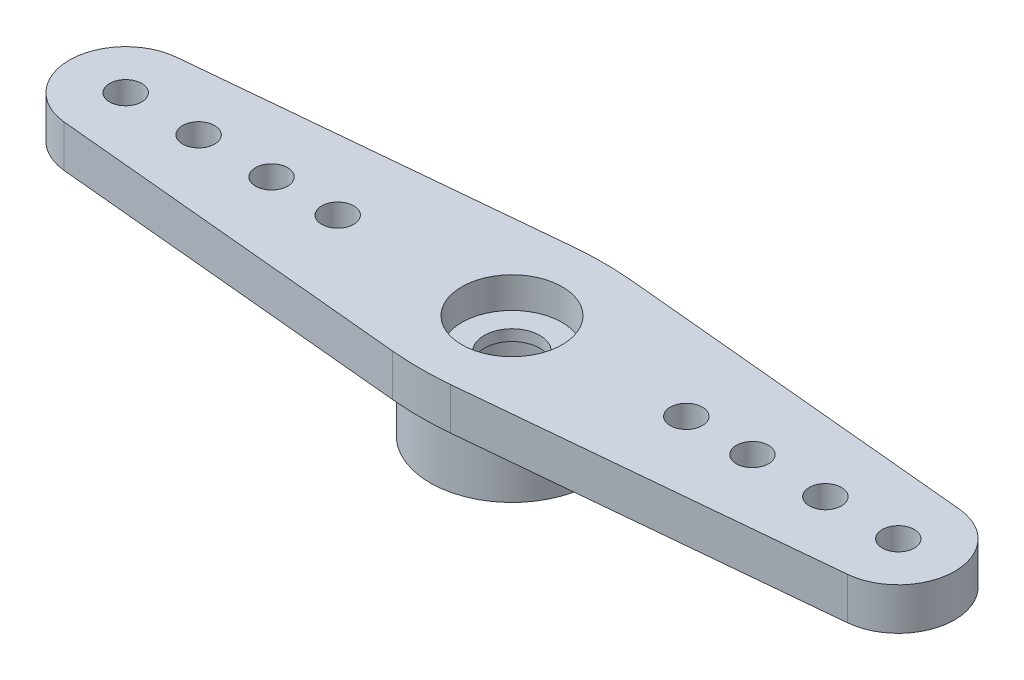
from build123d import *

# Parameters (mm, degrees)
SKETCH1_R           = 3.3655
SKETCH1_R_2         = 2.2352
BOSS_EXTRUDE1_DEPTH = 2.54
SKETCH2_R           = 0.6604
SKETCH2_R_2         = 2.31775
SKETCH2_R_3         = 3.3655
SKETCH2_R_4         = 2.2352
SKETCH2_R_5         = 1.143
BOSS_EXTRUDE2_DEPTH = 1.7272
FILLET1_R           = 12.7
CUT_EXTRUDE1_START  = -1.27
SKETCH3_R           = 2.06375
SKETCH3_R_2         = 1.143
CUT_EXTRUDE1_DEPTH  = 1.27
SCALE1_SCALE        = 1.483924155


with BuildPart() as part:
    # Sketch1 → Boss-Extrude1 (new body)
    with BuildSketch(Plane(origin=(0, 0, 0), x_dir=(1, 0, 0), z_dir=(0, 1, 0))):
        with Locations(Location((0, 0, 0), (0, 0, 270))):
            Circle(SKETCH1_R)
        with Locations(Location((0, 0, 0), (0, 0, 270))):
            Circle(SKETCH1_R_2, mode=Mode.SUBTRACT)
    extrude(amount=BOSS_EXTRUDE1_DEPTH)

    # Sketch2 → Boss-Extrude2 (add)
    # profile 1 of 7: a face of its own
    with BuildSketch(Plane(origin=(0, 2.54, 0), x_dir=(1, 0, 0), z_dir=(0, 1, 0))):
        with BuildLine():
            ThreePointArc((-0.713521748, -3.755518873), (-3.8227, 0), (-0.713521748, 3.755518873))
            Line((-0.713521748, 3.755518873), (-16.092265178, 2.307544345))
            ThreePointArc((-16.092265178, 2.307544345), (-14.314807913, 1.713991165), (-13.55725, 0))
            ThreePointArc((-13.55725, 0), (-14.314807913, -1.713991165), (-16.092265178, -2.307544345))
            Line((-16.092265178, -2.307544345), (-0.713521748, -3.755518873))
        make_face()
        with Locations(Location((-12.8778, 0, 0), (0, 0, 270))):
            Circle(SKETCH2_R, mode=Mode.SUBTRACT)
        with Locations(Location((-9.8806, 0, 0), (0, 0, 270))):
            Circle(SKETCH2_R, mode=Mode.SUBTRACT)
        with Locations(Location((-7.1628, 0, 0), (0, 0, 270))):
            Circle(SKETCH2_R, mode=Mode.SUBTRACT)
    # profile 2 of 7: a face of its own
    with BuildSketch(Plane(origin=(0, 2.54, 0), x_dir=(1, 0, 0), z_dir=(0, 1, 0))):
        with Locations((-15.875, 0)):
            Circle(SKETCH2_R_2)
        with Locations(Location((-15.875, 0, 0), (0, 0, 270))):
            Circle(SKETCH2_R, mode=Mode.SUBTRACT)
    # profile 3 of 7: a face of its own
    with BuildSketch(Plane(origin=(0, 2.54, 0), x_dir=(1, 0, 0), z_dir=(0, 1, 0))):
        with BuildLine():
            Line((16.092265178, 2.307544345), (0.713521748, 3.755518873))
            ThreePointArc((0.713521748, 3.755518873), (2.944538578, 2.437771083), (3.8227, 0))
            ThreePointArc((3.8227, 0), (2.944538578, -2.437771083), (0.713521748, -3.755518873))
            Line((0.713521748, -3.755518873), (16.092265178, -2.307544345))
            ThreePointArc((16.092265178, -2.307544345), (13.55725, 0), (16.092265178, 2.307544345))
        make_face()
        with Locations(Location((7.1628, 0, 0), (0, 0, 270))):
            Circle(SKETCH2_R, mode=Mode.SUBTRACT)
        with Locations(Location((9.8806, 0, 0), (0, 0, 270))):
            Circle(SKETCH2_R, mode=Mode.SUBTRACT)
        with Locations(Location((12.8778, 0, 0), (0, 0, 270))):
            Circle(SKETCH2_R, mode=Mode.SUBTRACT)
    # profile 4 of 7: a face of its own
    with BuildSketch(Plane(origin=(0, 2.54, 0), x_dir=(1, 0, 0), z_dir=(0, 1, 0))):
        with Locations((15.875, 0)):
            Circle(SKETCH2_R_2)
        with Locations(Location((15.875, 0, 0), (0, 0, 270))):
            Circle(SKETCH2_R, mode=Mode.SUBTRACT)
    # profile 5 of 7: a face of its own
    with BuildSketch(Plane(origin=(0, 2.54, 0), x_dir=(1, 0, 0), z_dir=(0, 1, 0))):
        with BuildLine():
            Line((0.713521748, 3.755518873), (0, 3.8227))
            Line((0, 3.8227), (-0.713521748, 3.755518873))
            ThreePointArc((-0.713521748, 3.755518873), (-3.8227, 0), (-0.713521748, -3.755518873))
            Line((-0.713521748, -3.755518873), (0, -3.8227))
            Line((0, -3.8227), (0.713521748, -3.755518873))
            ThreePointArc((0.713521748, -3.755518873), (2.944538578, -2.437771083), (3.8227, 0))
            ThreePointArc((3.8227, 0), (2.944538578, 2.437771083), (0.713521748, 3.755518873))
        make_face()
        with Locations(Location((0, 0, 0), (0, 0, 270))):
            Circle(SKETCH2_R_3, mode=Mode.SUBTRACT)
    # profile 6 of 7: a face of its own
    with BuildSketch(Plane(origin=(0, 2.54, 0), x_dir=(1, 0, 0), z_dir=(0, 1, 0))):
        with Locations(Location((0, 0, 0), (0, 0, 270))):
            Circle(SKETCH2_R_3)
        with Locations(Location((0, 0, 0), (0, 0, 270))):
            Circle(SKETCH2_R_4, mode=Mode.SUBTRACT)
    # profile 7 of 7: a face of its own
    with BuildSketch(Plane(origin=(0, 2.54, 0), x_dir=(1, 0, 0), z_dir=(0, 1, 0))):
        with Locations(Location((0, 0, 0), (0, 0, 270))):
            Circle(SKETCH2_R_4)
        with Locations(Location((0, 0, 0), (0, 0, 270))):
            Circle(SKETCH2_R_5, mode=Mode.SUBTRACT)
    extrude(amount=BOSS_EXTRUDE2_DEPTH)

    # Fillet1
    fillet1_edges = [part.edges().sort_by_distance(p)[0] for p in [
        (0, 3.4036, -3.8227),
        (0, 3.4036, 3.8227),
    ]]
    fillet(fillet1_edges, radius=FILLET1_R)

    # Sketch3 → Cut-Extrude1 (cut)
    with BuildSketch(Plane(origin=(0, 4.2672, 0), x_dir=(1, 0, 0), z_dir=(0, 1, 0)).offset(CUT_EXTRUDE1_START)):
        with Locations(Location((0, 0, 0), (0, 0, 270))):
            Circle(SKETCH3_R)
        with Locations(Location((0, 0, 0), (0, 0, 270))):
            Circle(SKETCH3_R_2, mode=Mode.SUBTRACT)
    extrude(amount=CUT_EXTRUDE1_DEPTH, mode=Mode.SUBTRACT)


with BuildPart() as part_1:
    # Scale1: scaled about (0, 3.112125365, 0)
    add(part.part.scale(SCALE1_SCALE).moved(Location((0, -1.506032637, 0))))


solid = part_1.part
